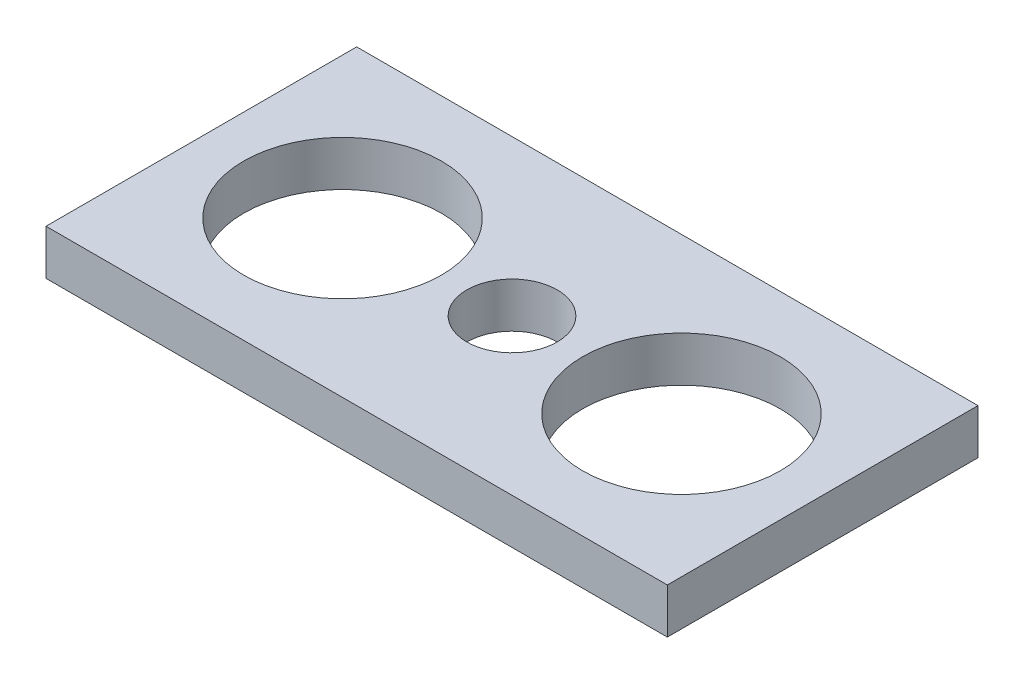
from build123d import *

# Parameters (mm, degrees)
SKETCH2_W           = 220
SKETCH2_H           = 110
SKETCH2_R           = 35
SKETCH2_R_2         = 16
BOSS_EXTRUDE1_DEPTH = 16


with BuildPart() as part:
    # Sketch2 → Boss-Extrude1 (new body)
    with BuildSketch(Plane(origin=(0, 0, 0), x_dir=(1, 0, 0), z_dir=(0, 1, 0))):
        with Locations((110, 55)):
            Rectangle(SKETCH2_W, SKETCH2_H)
        with Locations(Location((50, 55, 0), (0, 0, 270))):
            Circle(SKETCH2_R, mode=Mode.SUBTRACT)
        with Locations(Location((170, 55, 0), (0, 0, 270))):
            Circle(SKETCH2_R, mode=Mode.SUBTRACT)
        with Locations(Location((110, 55, 0), (0, 0, 270))):
            Circle(SKETCH2_R_2, mode=Mode.SUBTRACT)
    extrude(amount=BOSS_EXTRUDE1_DEPTH)


solid = part.part
